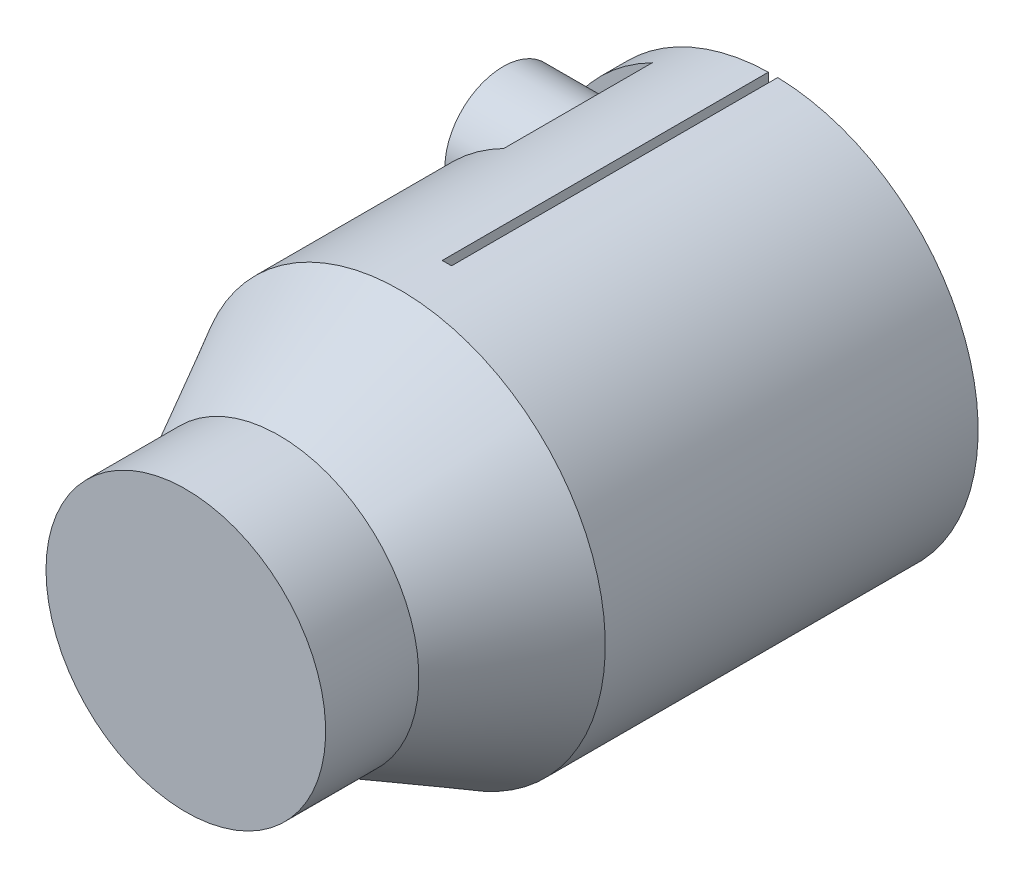
from build123d import *

# Parameters (mm, degrees)
SZKIC3_W                    = 1
SZKIC3_H                    = 17.528511895
WYTNIJ_WYCI_GNI_CIE1_DEPTH  = 35
WYTNIJ_WYCI_GNI_CIE4_DEPTH  = 12
SZKIC10_R                   = 6.25
DODANIE_WYCI_GNI_CIE5_DEPTH = 8
WYTNIJ_WYCI_GNI_CIE5_DEPTH  = 5
SZKIC12_R                   = 4
DODANIE_WYCI_GNI_CIE6_DEPTH = 23


with BuildPart() as part:
    # Szkic2 → Obrót1 (revolve)
    with BuildSketch(Plane(origin=(0, 0, 0), x_dir=(1, 0, 0), z_dir=(0, 1, 0))):
        Polygon((0, 0), (0, -40), (7, -53), (7, -63), (22, -63), (22, -40), (15, -40), (15, 0), align=None)
    revolve(axis=Axis((22, 0, 0), (0, 0, 1)))

    # Szkic3 → Wytnij-wyciągnięcie1 (cut)
    with BuildSketch(Plane(origin=(0, 0, 0), x_dir=(-1, 0, 0), z_dir=(0, 0, -1))):
        with Locations((-22, 13.789096025)):
            Rectangle(SZKIC3_W, SZKIC3_H)
    extrude(amount=-WYTNIJ_WYCI_GNI_CIE1_DEPTH, mode=Mode.SUBTRACT)

    # Szkic9 → Wytnij-wyciągnięcie4 (cut)
    with BuildSketch(Plane(origin=(0, 0, 0), x_dir=(0, 0, -1), z_dir=(1, 0, 0))):
        with BuildLine():
            Line((-2.956841624, 12.994317448), (-2.956841624, 31.011341841))
            Line((-2.956841624, 31.011341841), (-18.895064638, 31.011341841))
            Line((-18.895064638, 31.011341841), (-18.895064638, 12.002039571))
            ThreePointArc((-18.895064638, 12.002039571), (-10.459742092, 5.009776631), (-2.956841624, 12.994317448))
        make_face()
    extrude(amount=WYTNIJ_WYCI_GNI_CIE4_DEPTH, mode=Mode.SUBTRACT)

    # Szkic10 → Dodanie-wyciągnięcie5 (add)
    with BuildSketch(Plane.ZY.offset(-12)):
        with Locations(Location((10.956841624, 12.994317448, 0), (0, 0, 180))):
            Circle(SZKIC10_R)
    extrude(amount=DODANIE_WYCI_GNI_CIE5_DEPTH)

    # Szkic11 → Wytnij-wyciągnięcie5 (cut)
    with BuildSketch(Plane.ZY.offset(-4)):
        Polygon((14.360666712, 12.350908736), (13.215962457, 15.620412088), (9.812137369, 16.2638208), (7.553016536, 13.63772616), (8.697720791, 10.368222807), (12.101545879, 9.724814096), align=None)
    extrude(amount=-WYTNIJ_WYCI_GNI_CIE5_DEPTH, mode=Mode.SUBTRACT)

    # Szkic12 → Dodanie-wyciągnięcie6 (add)
    with BuildSketch(Plane.ZY.offset(-9)):
        with Locations((10.956841624, 12.994317448)):
            Circle(SZKIC12_R)
    extrude(amount=-DODANIE_WYCI_GNI_CIE6_DEPTH)


solid = part.part
